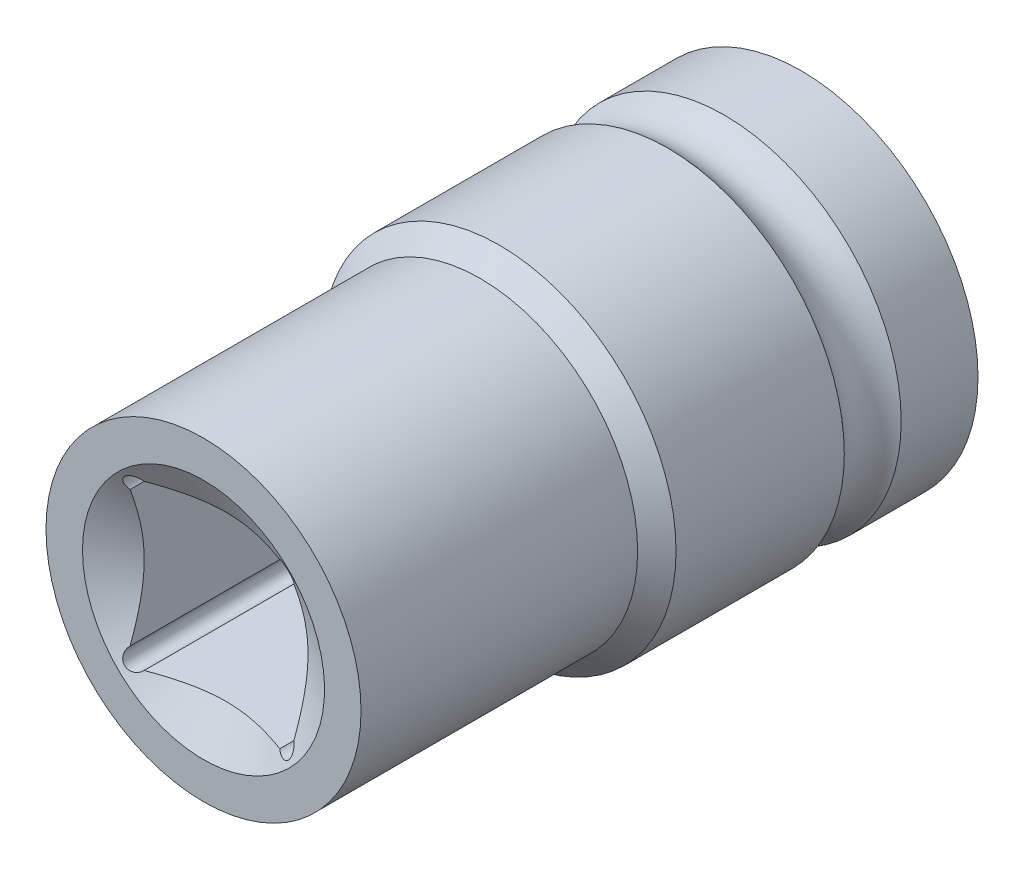
from build123d import *

# Parameters (mm, degrees)
CUT_EXTRUDE1_DEPTH = 30
SKETCH3_R          = 10
CUT_EXTRUDE2_DEPTH = 30
CUT_EXTRUDE3_DEPTH = 31.3


with BuildPart() as part:
    # Sketch1 → Revolve1 (revolve)
    with BuildSketch(Plane(origin=(0, 0, 0), x_dir=(0, 0, -1), z_dir=(1, 0, 0)), mode=Mode.PRIVATE) as revolve1_sk:
        with BuildLine():
            Line((0, 20.5), (0, 15.75))
            Line((0, 15.75), (9.09326674, 0))
            Line((9.09326674, 0), (66.830344885, 0))
            Line((66.830344885, 0), (77.8, 19))
            Line((77.8, 19), (77.8, 23))
            Line((77.8, 23), (67.8, 23))
            ThreePointArc((67.8, 23), (64.1, 21.2), (60.4, 23))
            Line((60.4, 23), (38.5, 23))
            Line((38.5, 23), (36, 20.5))
            Line((36, 20.5), (0, 20.5))
        make_face()
    revolve(revolve1_sk.sketch.rotate(Axis((0, 0, 0), (0, 0, 1)), 90), axis=Axis((0, 0, 0), (0, 0, 1)))

    # Sketch2 → Cut-Extrude1 (cut)
    with BuildSketch(Plane.XY):
        with BuildLine():
            Line((-10.66, 8.821522369), (-10.66, -8.821522369))
            ThreePointArc((-10.66, -8.821522369), (-10.66, -10.66), (-8.821522369, -10.66))
            Line((-8.821522369, -10.66), (8.821522369, -10.66))
            ThreePointArc((8.821522369, -10.66), (10.66, -10.66), (10.66, -8.821522369))
            Line((10.66, -8.821522369), (10.66, 8.821522369))
            ThreePointArc((10.66, 8.821522369), (10.66, 10.66), (8.821522369, 10.66))
            Line((8.821522369, 10.66), (-8.821522369, 10.66))
            ThreePointArc((-8.821522369, 10.66), (-10.66, 10.66), (-10.66, 8.821522369))
        make_face()
    extrude(amount=-CUT_EXTRUDE1_DEPTH, mode=Mode.SUBTRACT)

    # Sketch3 → Cut-Extrude2 (cut)
    with BuildSketch(Plane.XY.offset(-30)):
        Circle(SKETCH3_R)
    extrude(amount=-CUT_EXTRUDE2_DEPTH, mode=Mode.SUBTRACT)

    # Sketch4 → Cut-Extrude3 (cut)
    with BuildSketch(Plane(origin=(0, 0, -77.8), x_dir=(-1, 0, 0), z_dir=(0, 0, -1))):
        with BuildLine():
            Line((-12.85, -9.668019485), (-12.85, 9.668019485))
            ThreePointArc((-12.85, 9.668019485), (-12.85, 12.85), (-9.668019485, 12.85))
            Line((-9.668019485, 12.85), (9.668019485, 12.85))
            ThreePointArc((9.668019485, 12.85), (12.85, 12.85), (12.85, 9.668019485))
            Line((12.85, 9.668019485), (12.85, -9.668019485))
            ThreePointArc((12.85, -9.668019485), (12.85, -12.85), (9.668019485, -12.85))
            Line((9.668019485, -12.85), (-9.668019485, -12.85))
            ThreePointArc((-9.668019485, -12.85), (-12.85, -12.85), (-12.85, -9.668019485))
        make_face()
    extrude(amount=-CUT_EXTRUDE3_DEPTH, mode=Mode.SUBTRACT)


solid = part.part
